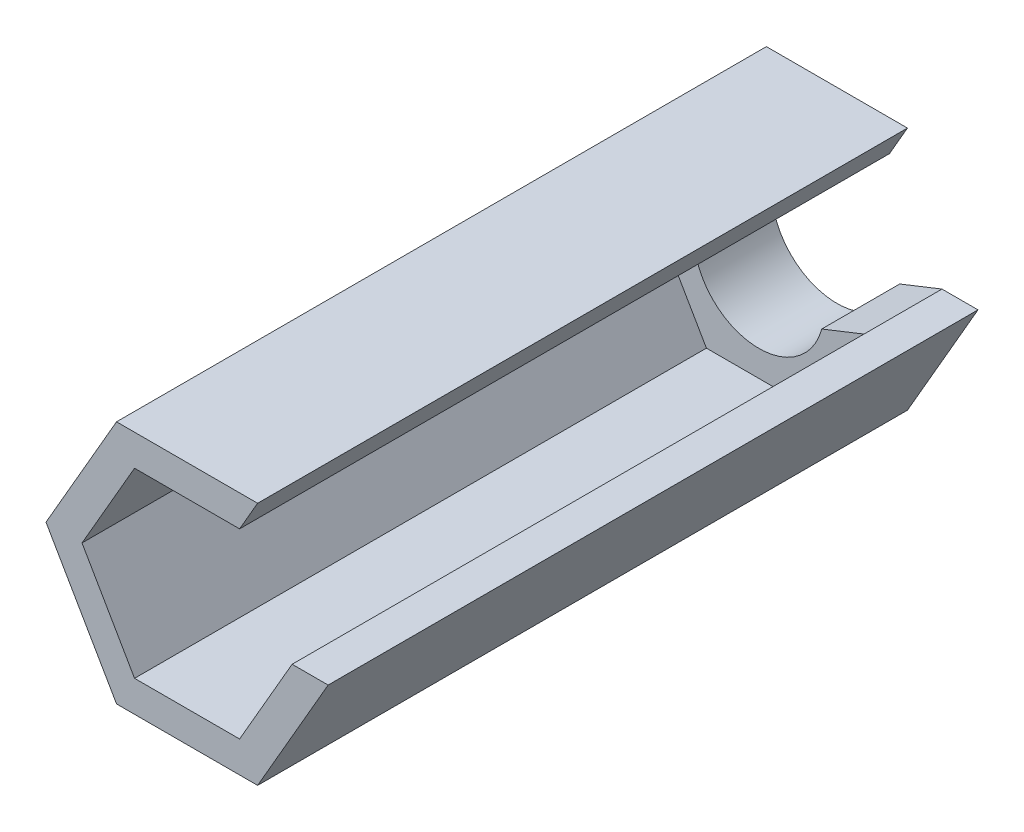
from build123d import *

# Parameters (mm, degrees)
BOSS_EXTRUDE1_DEPTH = 31.75
BOSS_EXTRUDE2_DEPTH = 3.81


with BuildPart() as part:
    # Sketch2 → Boss-Extrude1 (new body)
    with BuildSketch(Plane.XY):
        Polygon((2.566321947, 4.445), (3.446203757, 5.969), (-3.446203757, 5.969), (-6.892407514, 0), (-3.446203757, -5.969), (3.446203757, -5.969), (6.892407514, 0), (5.132643893, 0), (2.566321947, -4.445), (-2.566321947, -4.445), (-5.132643893, 0), (-2.566321947, 4.445), align=None)
    extrude(amount=BOSS_EXTRUDE1_DEPTH)

    # Sketch3 → Boss-Extrude2 (add)
    with BuildSketch(Plane(origin=(0, 0, 0), x_dir=(-1, 0, 0), z_dir=(0, 0, -1))):
        with BuildLine():
            Line((-5.132643893, 0), (-3.068091577, -0.816969447))
            ThreePointArc((-3.068091577, -0.816969447), (2.749630657, -1.5875), (-0.826529493, 3.06552997))
            Line((-0.826529493, 3.06552997), (-2.566321947, 4.445))
            Line((-2.566321947, 4.445), (2.566321947, 4.445))
            Line((2.566321947, 4.445), (5.132643893, 0))
            Line((5.132643893, 0), (2.566321947, -4.445))
            Line((2.566321947, -4.445), (-2.566321947, -4.445))
            Line((-2.566321947, -4.445), (-5.132643893, 0))
        make_face()
    extrude(amount=-BOSS_EXTRUDE2_DEPTH)


solid = part.part
